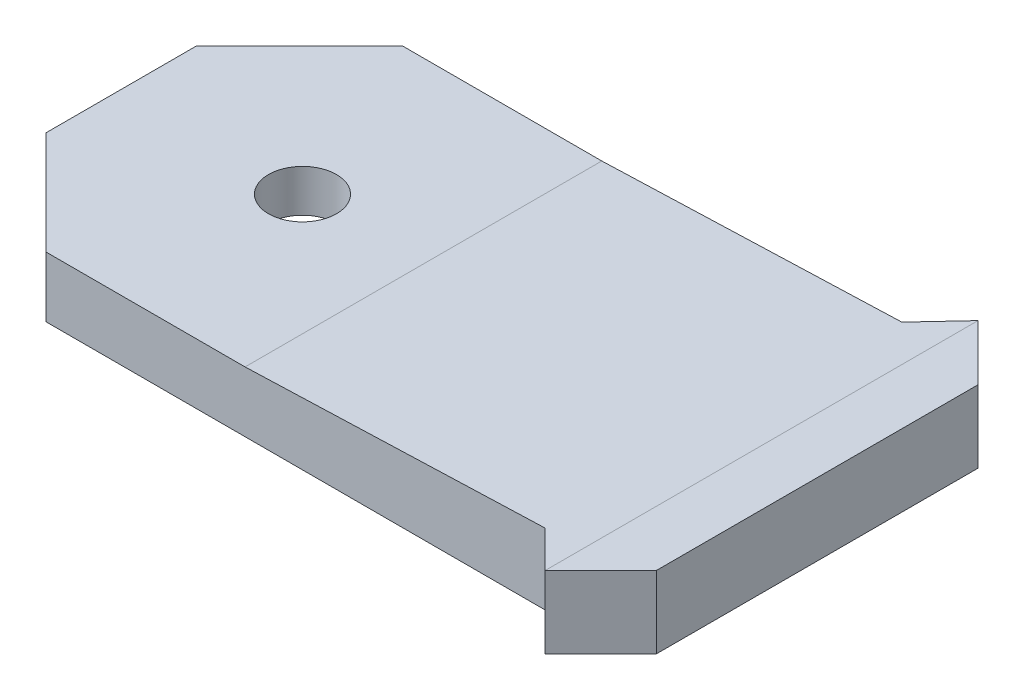
from build123d import *

# Parameters (mm, degrees)
SKETCH1_R               = 2.25
BOSS_EXTRUDE1_DEPTH     = 6
SKETCH2_R               = 10
CUT_EXTRUDE1_DEPTH      = 1.2
CUT_EXTRUDE2_DEPTH      = 54.27936377
CUT_EXTRUDE2_DEPTH_BACK = 54.27936377


with BuildPart() as part:
    # Sketch1 → Boss-Extrude1 (new body)
    with BuildSketch(Plane(origin=(0, 0, 0), x_dir=(1, 0, 0), z_dir=(0, 1, 0))):
        Polygon((0, 4.970562748), (0, -4.970562748), (6.829437252, -11.8), (39.85294373, -11.8), (39.86294373, -11.81), (40.05294373, -12), (42.371856048, -14.318912318), (46.04881131, -10.641957056), (46.04881131, 10.641957056), (42.371856048, 14.318912318), (40.05294373, 12), (39.86294373, 11.81), (39.85294373, 11.8), (6.829437252, 11.8), align=None)
        with Locations(Location((12, 0, 0), (0, 0, 270))):
            Circle(SKETCH1_R, mode=Mode.SUBTRACT)
    extrude(amount=BOSS_EXTRUDE1_DEPTH)

    # Sketch2 → Cut-Extrude1 (cut)
    with BuildSketch(Plane.XZ):
        with Locations(Location((12, 0, 0), (0, 0, 270))):
            Circle(SKETCH2_R)
    extrude(amount=-CUT_EXTRUDE1_DEPTH, mode=Mode.SUBTRACT)

    # Sketch3 → Cut-Extrude2 (cut, two sides: drawn at the far end of the back side and taken through both)
    with BuildSketch(Plane(origin=(0, 0, -11.8), x_dir=(-1, 0, 0), z_dir=(0, 0, -1)).offset(-CUT_EXTRUDE2_DEPTH_BACK)):
        Polygon((-46.04881131, 6), (0, 6), (0, 4), (-20, 4), (-42.371856048, 4.781242428), (-46.04881131, 4.781242428), align=None)
    extrude(amount=CUT_EXTRUDE2_DEPTH + CUT_EXTRUDE2_DEPTH_BACK, mode=Mode.SUBTRACT)


solid = part.part
